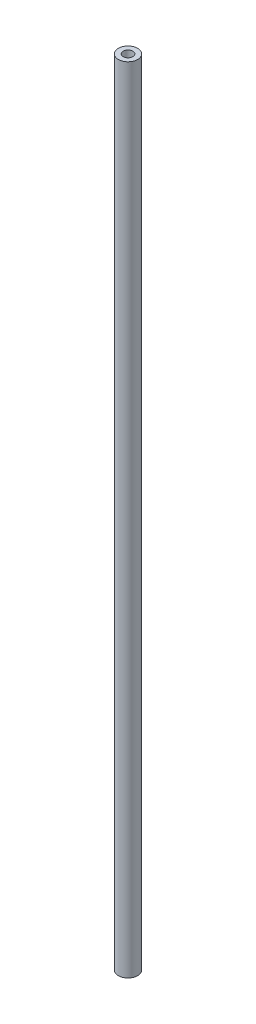
from build123d import *

# Parameters (mm, degrees)
CROQUIS1_W = 1
CROQUIS1_H = 164


with BuildPart() as part:
    # Croquis1 → Revolución1 (revolve)
    with BuildSketch(Plane.XY, mode=Mode.PRIVATE) as revoluci_n1_sk:
        with Locations((-1.5, 82)):
            Rectangle(CROQUIS1_W, CROQUIS1_H)
    revolve(revoluci_n1_sk.sketch.rotate(Axis((0, 0, 0), (0, 1, 0)), 270), axis=Axis((0, 0, 0), (0, 1, 0)))


solid = part.part
